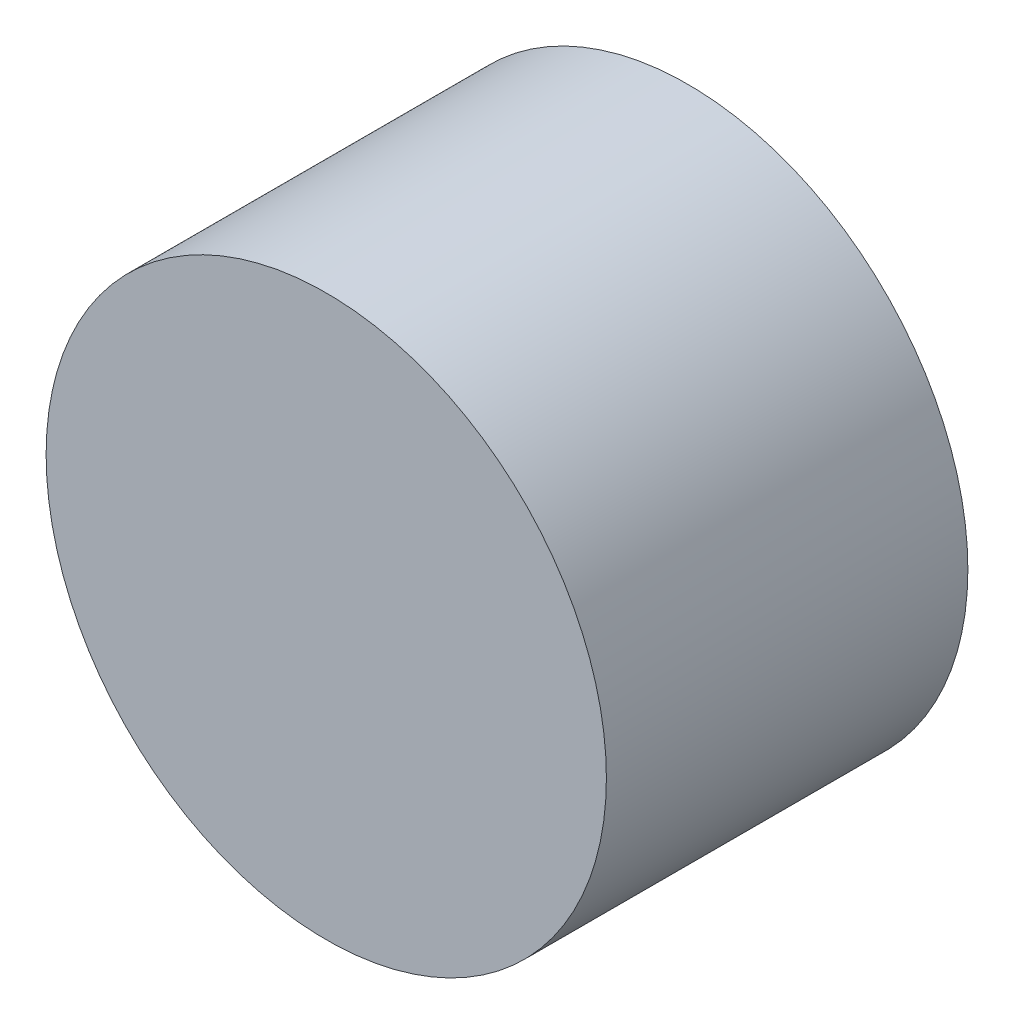
from build123d import *

# Parameters (mm, degrees)
ESQUISSE1_R        = 23.25
BOSS_EXTRU_1_DEPTH = 30


with BuildPart() as part:
    # Esquisse1 → Boss.-Extru.1 (new body)
    with BuildSketch(Plane.XY):
        Circle(ESQUISSE1_R)
    extrude(amount=BOSS_EXTRU_1_DEPTH)


solid = part.part
